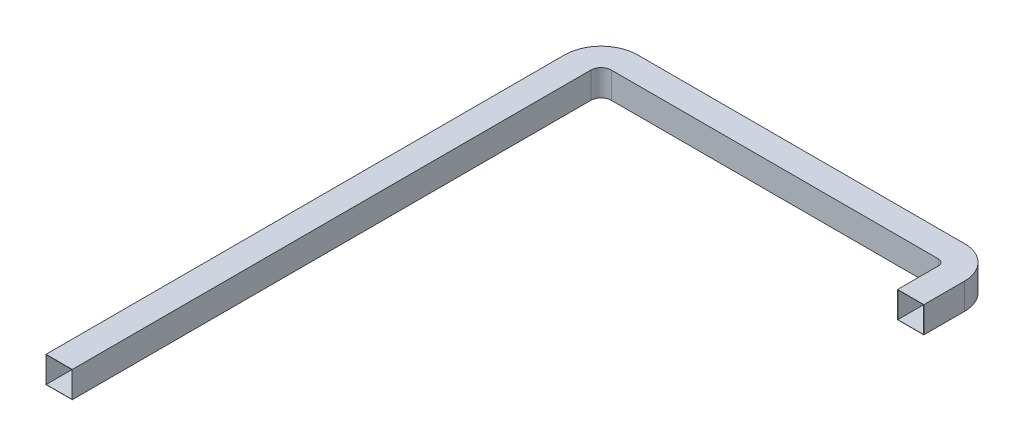
from build123d import *

# Parameters (mm, degrees)
SKETCH2_W            = 309.88
SKETCH2_H            = 309.88
SKETCH2_W_2          = 304.8
SKETCH2_H_2          = 304.8
BOSS_EXTRUDE1_DEPTH  = 228.6
BOSS_EXTRUDE6_DEPTH  = 309.88
SHELL1_T             = -2.54
SKETCH9_W            = 304.8
SKETCH9_H            = 304.8
CUT_EXTRUDE2_DEPTH   = 547.442497249
SKETCH10_W           = 309.88
SKETCH10_H           = 309.88
SKETCH10_W_2         = 304.8
SKETCH10_H_2         = 304.8
BOSS_EXTRUDE8_DEPTH  = 3810
BOSS_EXTRUDE9_DEPTH  = 309.88
SHELL2_T             = -2.54
SKETCH12_W           = 309.88
SKETCH12_H           = 309.88
SKETCH12_W_2         = 304.8
SKETCH12_H_2         = 304.8
BOSS_EXTRUDE10_DEPTH = 6096


with BuildPart() as part:
    # Sketch2 → Boss-Extrude1 (new, symmetric)
    with BuildSketch(Plane.XY):
        Rectangle(SKETCH2_W, SKETCH2_H)
        Rectangle(SKETCH2_W_2, SKETCH2_H_2, mode=Mode.SUBTRACT)
    extrude(amount=BOSS_EXTRUDE1_DEPTH, both=True)

    # Sketch8 → Boss-Extrude6 (add)
    with BuildSketch(Plane(origin=(0, 154.94, 0), x_dir=(1, 0, 0), z_dir=(0, 1, 0))):
        with BuildLine():
            Line((154.94, 228.6), (-154.94, 228.6))
            Line((-154.94, 228.6), (-154.94, 254))
            ThreePointArc((-154.94, 254), (-175.770565722, 304.289434278), (-226.06, 325.12))
            Line((-226.06, 325.12), (-251.46, 325.12))
            Line((-251.46, 325.12), (-251.46, 635))
            Line((-251.46, 635), (-226.06, 635))
            ThreePointArc((-226.06, 635), (43.347683632, 523.407683632), (154.94, 254))
            Line((154.94, 254), (154.94, 228.6))
        make_face()
    extrude(amount=-BOSS_EXTRUDE6_DEPTH)

    # Shell1
    shell1_openings = [part.faces().sort_by_distance(p)[0] for p in [
        (-251.46, 0, -480.06),
    ]]
    offset(amount=SHELL1_T, openings=shell1_openings, kind=Kind.INTERSECTION)

    # Sketch9 → Cut-Extrude2 (cut, through all)
    with BuildSketch(Plane(origin=(0, 0, -231.14), x_dir=(-1, 0, 0), z_dir=(0, 0, -1))):
        Rectangle(SKETCH9_W, SKETCH9_H)
    extrude(amount=-CUT_EXTRUDE2_DEPTH, mode=Mode.SUBTRACT)

    # Sketch10 → Boss-Extrude8 (add)
    with BuildSketch(Plane.ZY.offset(251.46)):
        with Locations((-480.06, 0)):
            Rectangle(SKETCH10_W, SKETCH10_H)
        with Locations((-480.06, 0)):
            Rectangle(SKETCH10_W_2, SKETCH10_H_2, mode=Mode.SUBTRACT)
    extrude(amount=BOSS_EXTRUDE8_DEPTH)

    # Sketch11 → Boss-Extrude9 (add)
    with BuildSketch(Plane.XZ.offset(154.94)):
        with BuildLine():
            Line((-4061.46, -325.12), (-4086.86, -325.12))
            ThreePointArc((-4086.86, -325.12), (-4173.070458762, -289.410458762), (-4208.78, -203.2))
            Line((-4208.78, -203.2), (-4208.78, -177.8))
            Line((-4208.78, -177.8), (-4518.66, -177.8))
            Line((-4518.66, -177.8), (-4518.66, -203.2))
            ThreePointArc((-4518.66, -203.2), (-4392.188708116, -508.528708116), (-4086.86, -635))
            Line((-4086.86, -635), (-4061.46, -635))
            Line((-4061.46, -635), (-4061.46, -325.12))
        make_face()
    extrude(amount=-BOSS_EXTRUDE9_DEPTH)

    # Shell2
    shell2_openings = [part.faces().sort_by_distance(p)[0] for p in [
        (-4363.72, 0, -177.8),
    ]]
    offset(amount=SHELL2_T, openings=shell2_openings, kind=Kind.INTERSECTION)

    # Sketch12 → Boss-Extrude10 (add)
    with BuildSketch(Plane.XY.offset(-177.8)):
        with Locations((-4363.72, 0)):
            Rectangle(SKETCH12_W, SKETCH12_H)
        with Locations((-4363.72, 0)):
            Rectangle(SKETCH12_W_2, SKETCH12_H_2, mode=Mode.SUBTRACT)
    extrude(amount=BOSS_EXTRUDE10_DEPTH)


solid = part.part
